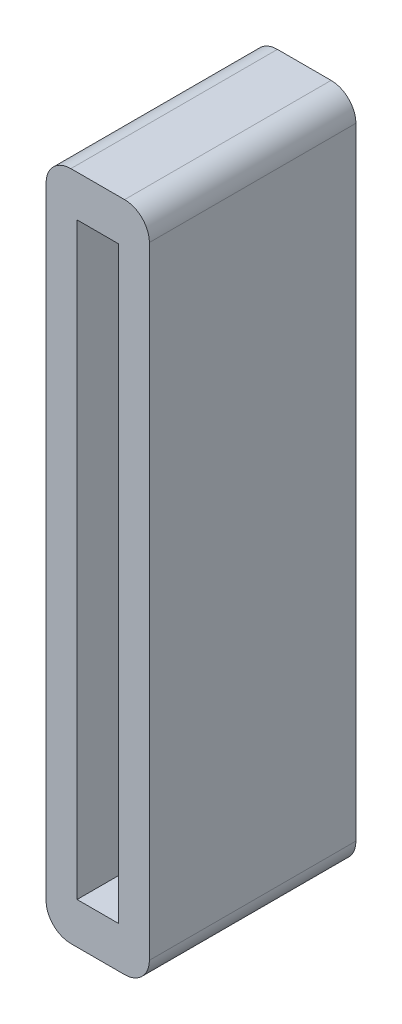
from build123d import *

# Parameters (mm, degrees)
SKETCH1_W           = 4
SKETCH1_H           = 57
BOSS_EXTRUDE1_DEPTH = 10


with BuildPart() as part:
    # Sketch1 → Boss-Extrude1 (new, symmetric)
    with BuildSketch(Plane.XY):
        with BuildLine():
            Line((-2.6, 32.5), (2.6, 32.5))
            ThreePointArc((2.6, 32.5), (4.297056275, 31.797056275), (5, 30.1))
            Line((5, 30.1), (5, -30.1))
            ThreePointArc((5, -30.1), (4.297056275, -31.797056275), (2.6, -32.5))
            Line((2.6, -32.5), (-2.6, -32.5))
            ThreePointArc((-2.6, -32.5), (-4.297056275, -31.797056275), (-5, -30.1))
            Line((-5, -30.1), (-5, 30.1))
            ThreePointArc((-5, 30.1), (-4.297056275, 31.797056275), (-2.6, 32.5))
        make_face()
        Rectangle(SKETCH1_W, SKETCH1_H, mode=Mode.SUBTRACT)
    extrude(amount=BOSS_EXTRUDE1_DEPTH, both=True)


solid = part.part
